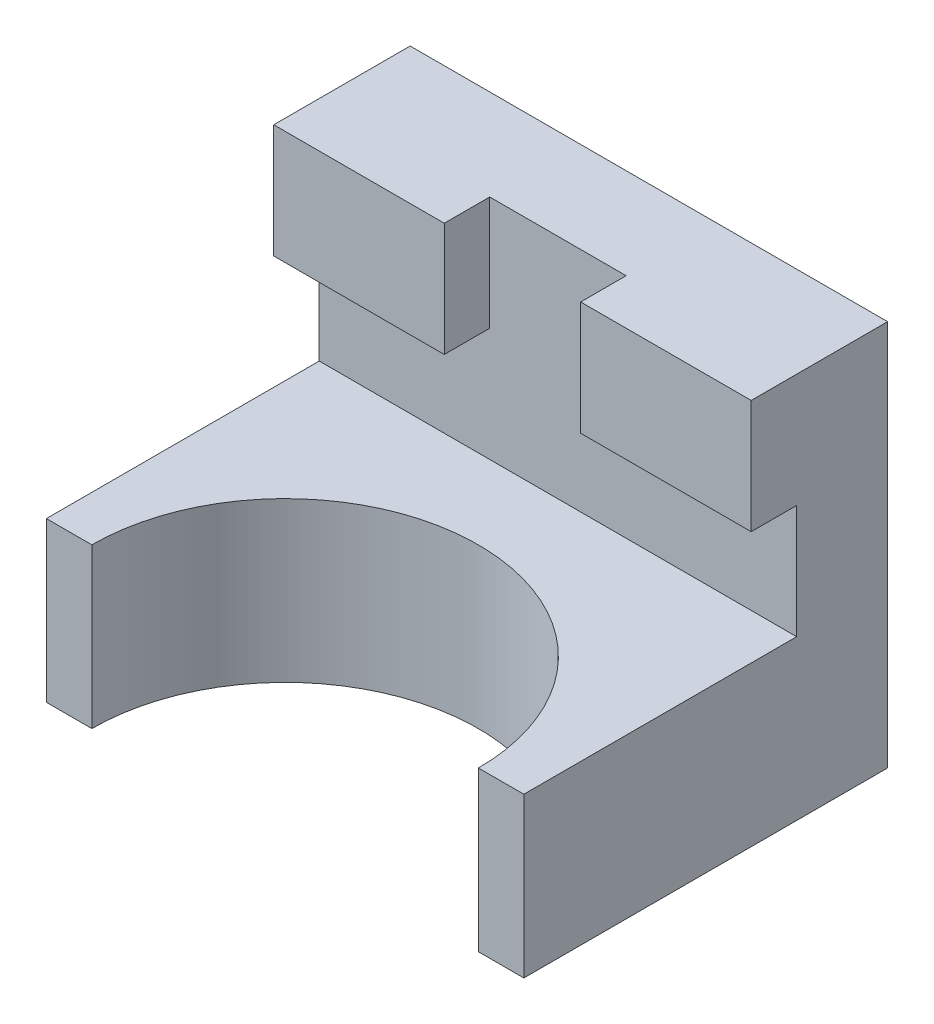
from build123d import *

# Parameters (mm, degrees)
EXTRUDE_1_DEPTH     = 105
SKETCH_23_W         = 30
SKETCH_23_H         = 10
CUT_EXTRUDE_1_DEPTH = 25
SKETCH_24_R         = 42.5
CUT_EXTRUDE_3_DEPTH = 35


with BuildPart() as part:
    # Эскиз2 → Бобышка-Вытянуть1 (new body)
    with BuildSketch(Plane(origin=(0, 0, 0), x_dir=(0, 0, -1), z_dir=(1, 0, 0))):
        Polygon((0, 0), (0, -85), (-80, -85), (-80, -50), (-20, -50), (-20, -25), (-30, -25), (-30, 0), align=None)
    extrude(amount=EXTRUDE_1_DEPTH)

    # Эскиз23 → Вырез-Вытянуть1 (cut)
    with BuildSketch(Plane(origin=(0, 0, 0), x_dir=(1, 0, 0), z_dir=(0, 1, 0))):
        with Locations((52.5, -25)):
            Rectangle(SKETCH_23_W, SKETCH_23_H)
    extrude(amount=-CUT_EXTRUDE_1_DEPTH, mode=Mode.SUBTRACT)

    # Эскиз24 → Вырез-Вытянуть3 (cut)
    with BuildSketch(Plane(origin=(0, -50, 0), x_dir=(1, 0, 0), z_dir=(0, 1, 0))):
        with Locations((52.5, -80)):
            Circle(SKETCH_24_R)
    extrude(amount=-CUT_EXTRUDE_3_DEPTH, mode=Mode.SUBTRACT)


solid = part.part
